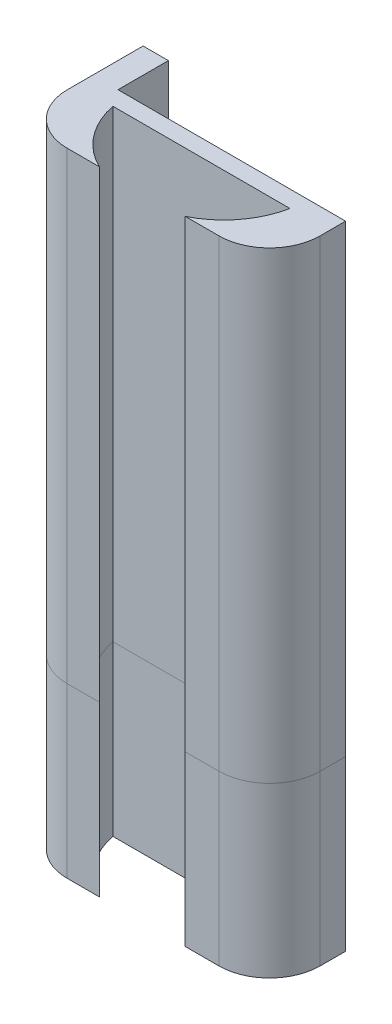
from build123d import *

# Parameters (mm, degrees)
SKETCH1_W              = 75
SKETCH1_H              = 30
BOSS_EXTRUDE1_DEPTH    = 15
SKETCH2_W              = 10.2
SKETCH2_H              = 7.02
SKETCH2_W_2            = 24
SKETCH2_H_2            = 5.98
CUT_EXTRUDE1_DEPTH     = 78.942286341
CUT_EXTRUDE2_DEPTH     = 51.311529494
FILLET2_R              = 6
SKETCH5_W              = 3
SKETCH5_H              = 5.98
CUT_EXTRUDE3_DEPTH     = 78.942286341
SPLIT1_SURFACE_1_BACK  = 83.158
SPLIT1_SURFACE_1_DEPTH = 166.316
SPLIT1_SURFACE_2_BACK  = 83.158
SPLIT1_SURFACE_2_DEPTH = 166.316


with BuildPart() as part:
    # Sketch1 → Boss-Extrude1 (new body)
    with BuildSketch(Plane(origin=(0, 0, 0), x_dir=(0, 1, 0), z_dir=(0, 0, 1))):
        Rectangle(SKETCH1_W, SKETCH1_H)
    extrude(amount=BOSS_EXTRUDE1_DEPTH)

    # Sketch2 → Cut-Extrude1 (cut, through all)
    with BuildSketch(Plane(origin=(0, 37.5, 0), x_dir=(-1, 0, 0), z_dir=(0, 1, 0))):
        with BuildLine():
            ThreePointArc((-10.4, 7.98), (-8.519540319, 12.12041563), (-5, 15))
            Line((-5, 15), (-5, 7.98))
            Line((-5, 7.98), (-10.4, 7.98))
        make_face()
        with Locations((0.1, 11.49)):
            Rectangle(SKETCH2_W, SKETCH2_H)
        with BuildLine():
            ThreePointArc((5.2, 15), (8.719540319, 12.12041563), (10.6, 7.98))
            Line((10.6, 7.98), (5.2, 7.98))
            Line((5.2, 7.98), (5.2, 15))
        make_face()
        with Locations((0, 2.99)):
            Rectangle(SKETCH2_W_2, SKETCH2_H_2)
    extrude(amount=-CUT_EXTRUDE1_DEPTH, mode=Mode.SUBTRACT)

    # Sketch3 → Cut-Extrude2 (cut, through all)
    with BuildSketch(Plane.YZ.offset(15)):
        with BuildLine():
            Line((2.433108223, 2.5), (0.861958837, 3.835399675))
            ThreePointArc((0.861958837, 3.835399675), (-1.576526263, 2.525277483), (0.845247168, 1.184515316))
            Line((0.845247168, 1.184515316), (2.433108223, 2.5))
        make_face()
        with BuildLine():
            Line((-20.001296975, 2.5), (-21.249987066, 1.50126697))
            ThreePointArc((-21.249987066, 1.50126697), (-24.1, 2.499983501), (-21.250007664, 3.49875881))
            Line((-21.250007664, 3.49875881), (-20.001296975, 2.5))
        make_face()
        with BuildLine():
            Line((20.001296975, 2.5), (21.249987066, 1.50126697))
            ThreePointArc((21.249987066, 1.50126697), (24.1, 2.499983501), (21.250007664, 3.49875881))
            Line((21.250007664, 3.49875881), (20.001296975, 2.5))
        make_face()
    extrude(amount=-CUT_EXTRUDE2_DEPTH, mode=Mode.SUBTRACT)

    # Fillet2
    fillet2_edges = [part.edges().sort_by_distance(p)[0] for p in [
        (15, 0, 15),
        (-15, 0, 15),
    ]]
    fillet(fillet2_edges, radius=FILLET2_R)

    # Sketch5 → Cut-Extrude3 (cut, through all)
    with BuildSketch(Plane.XZ.offset(37.5)):
        with Locations((13.5, 2.99)):
            Rectangle(SKETCH5_W, SKETCH5_H)
    extrude(amount=-CUT_EXTRUDE3_DEPTH, mode=Mode.SUBTRACT)


with BuildPart() as body_2:
    # Split1: the piece behind the surface
    add(part.part)
    # Split1 surface: a surface, the sketch's curves swept straight by 166.316 mm
    with BuildLine(Plane(origin=(0, 0, 0), x_dir=(1, 0, 0), z_dir=(0, 0, -1)).offset(-SPLIT1_SURFACE_1_BACK), mode=Mode.PRIVATE) as split1_surface_1_path:
        Line((-15, 17.5), (15, 17.5))
    split1_surface_1 = Shell.extrude(split1_surface_1_path.wire(), (0 * SPLIT1_SURFACE_1_DEPTH, 0 * SPLIT1_SURFACE_1_DEPTH, -1 * SPLIT1_SURFACE_1_DEPTH))
    split(bisect_by=split1_surface_1, keep=Keep.BOTTOM)


with BuildPart() as part_1:
    add(part.part)

    # Split1: split by a surface, the side it looks to stays
    # Split1 surface: a surface, the sketch's curves swept straight by 166.316 mm
    with BuildLine(Plane(origin=(0, 0, 0), x_dir=(1, 0, 0), z_dir=(0, 0, -1)).offset(-SPLIT1_SURFACE_2_BACK), mode=Mode.PRIVATE) as split1_surface_2_path:
        Line((-15, 17.5), (15, 17.5))
    split1_surface_2 = Shell.extrude(split1_surface_2_path.wire(), (0 * SPLIT1_SURFACE_2_DEPTH, 0 * SPLIT1_SURFACE_2_DEPTH, -1 * SPLIT1_SURFACE_2_DEPTH))
    split(bisect_by=split1_surface_2, keep=Keep.TOP)


solid = Compound([body_2.part, part_1.part])
